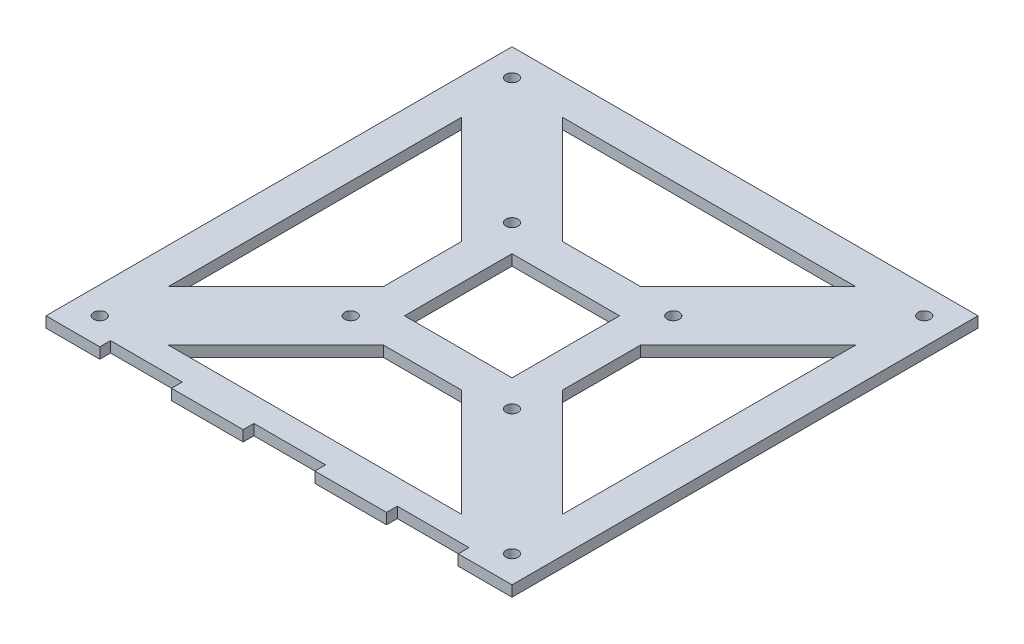
from build123d import *

# Parameters (mm, degrees)
SKETCH1_W           = 130
SKETCH1_H           = 130
SKETCH1_W_2         = 30
SKETCH1_H_2         = 30
BOSS_EXTRUDE1_DEPTH = 3
CUT_EXTRUDE1_DEPTH  = 3
CUT_EXTRUDE2_DEPTH  = 3
SKETCH4_W           = 20
SKETCH4_H           = 3
SKETCH4_W_2         = 10
CUT_EXTRUDE3_DEPTH  = 10


with BuildPart() as part:
    # Sketch1 → Boss-Extrude1 (new body)
    with BuildSketch(Plane(origin=(0, 0, 0), x_dir=(1, 0, 0), z_dir=(0, 1, 0))):
        Rectangle(SKETCH1_W, SKETCH1_H)
        Polygon((-55, 40.857864376), (-25, 10.857864376), (-25, -10.857864376), (-55, -40.857864376), align=None, mode=Mode.SUBTRACT)
        Polygon((-40.857864376, -55), (-10.857864376, -25), (10.857864376, -25), (40.857864376, -55), align=None, mode=Mode.SUBTRACT)
        Polygon((55, -40.857864376), (25, -10.857864376), (25, 10.857864376), (55, 40.857864376), align=None, mode=Mode.SUBTRACT)
        Polygon((40.857864376, 55), (10.857864376, 25), (-10.857864376, 25), (-40.857864376, 55), align=None, mode=Mode.SUBTRACT)
        Rectangle(SKETCH1_W_2, SKETCH1_H_2, mode=Mode.SUBTRACT)
    extrude(amount=BOSS_EXTRUDE1_DEPTH)

    # Sketch2 → Cut-Extrude1 (cut)
    with BuildSketch(Plane(origin=(0, 3, 0), x_dir=(1, 0, 0), z_dir=(0, 1, 0))):
        with BuildLine():
            ThreePointArc((-55.8, 57.5), (-58.702081528, 58.702081528), (-57.5, 55.8))
            Line((-57.5, 55.8), (-57.5, 57.5))
            Line((-57.5, 57.5), (-55.8, 57.5))
        make_face()
        with BuildLine():
            Line((-57.5, 57.5), (-57.5, 55.8))
            ThreePointArc((-57.5, 55.8), (-56.297918472, 56.297918472), (-55.8, 57.5))
            Line((-55.8, 57.5), (-57.5, 57.5))
        make_face()
        with BuildLine():
            Line((-57.5, -55.8), (-57.5, -57.5))
            Line((-57.5, -57.5), (-55.8, -57.5))
            ThreePointArc((-55.8, -57.5), (-56.297918472, -56.297918472), (-57.5, -55.8))
        make_face()
        with BuildLine():
            Line((-55.8, -57.5), (-57.5, -57.5))
            Line((-57.5, -57.5), (-57.5, -55.8))
            ThreePointArc((-57.5, -55.8), (-58.702081528, -58.702081528), (-55.8, -57.5))
        make_face()
        with BuildLine():
            ThreePointArc((57.5, -55.8), (56.297918472, -56.297918472), (55.8, -57.5))
            Line((55.8, -57.5), (57.5, -57.5))
            Line((57.5, -57.5), (57.5, -55.8))
        make_face()
        with BuildLine():
            Line((57.5, -57.5), (55.8, -57.5))
            ThreePointArc((55.8, -57.5), (57.5, -59.2), (59.2, -57.5))
            ThreePointArc((59.2, -57.5), (58.702081528, -56.297918472), (57.5, -55.8))
            Line((57.5, -55.8), (57.5, -57.5))
        make_face()
        with BuildLine():
            ThreePointArc((55.8, 57.5), (56.297918472, 56.297918472), (57.5, 55.8))
            Line((57.5, 55.8), (57.5, 57.5))
            Line((57.5, 57.5), (55.8, 57.5))
        make_face()
        with BuildLine():
            Line((57.5, 57.5), (57.5, 55.8))
            ThreePointArc((57.5, 55.8), (58.702081528, 56.297918472), (59.2, 57.5))
            ThreePointArc((59.2, 57.5), (57.5, 59.2), (55.8, 57.5))
            Line((55.8, 57.5), (57.5, 57.5))
        make_face()
    extrude(amount=-CUT_EXTRUDE1_DEPTH, mode=Mode.SUBTRACT)

    # Sketch3 → Cut-Extrude2 (cut)
    with BuildSketch(Plane(origin=(0, 3, 0), x_dir=(1, 0, 0), z_dir=(0, 1, 0))):
        with BuildLine():
            Line((-22.5, -20.8), (-22.5, -22.5))
            Line((-22.5, -22.5), (-20.8, -22.5))
            ThreePointArc((-20.8, -22.5), (-21.297918472, -21.297918472), (-22.5, -20.8))
        make_face()
        with BuildLine():
            Line((-20.8, -22.5), (-22.5, -22.5))
            Line((-22.5, -22.5), (-22.5, -20.8))
            ThreePointArc((-22.5, -20.8), (-23.702081528, -23.702081528), (-20.8, -22.5))
        make_face()
        with BuildLine():
            ThreePointArc((-20.8, 22.5), (-23.702081528, 23.702081528), (-22.5, 20.8))
            Line((-22.5, 20.8), (-22.5, 22.5))
            Line((-22.5, 22.5), (-20.8, 22.5))
        make_face()
        with BuildLine():
            Line((-22.5, 22.5), (-22.5, 20.8))
            ThreePointArc((-22.5, 20.8), (-21.297918472, 21.297918472), (-20.8, 22.5))
            Line((-20.8, 22.5), (-22.5, 22.5))
        make_face()
        with BuildLine():
            ThreePointArc((22.5, -20.8), (21.297918472, -21.297918472), (20.8, -22.5))
            Line((20.8, -22.5), (22.5, -22.5))
            Line((22.5, -22.5), (22.5, -20.8))
        make_face()
        with BuildLine():
            Line((22.5, -22.5), (20.8, -22.5))
            ThreePointArc((20.8, -22.5), (22.5, -24.2), (24.2, -22.5))
            ThreePointArc((24.2, -22.5), (23.702081528, -21.297918472), (22.5, -20.8))
            Line((22.5, -20.8), (22.5, -22.5))
        make_face()
        with BuildLine():
            ThreePointArc((20.8, 22.5), (21.297918472, 21.297918472), (22.5, 20.8))
            Line((22.5, 20.8), (22.5, 22.5))
            Line((22.5, 22.5), (20.8, 22.5))
        make_face()
        with BuildLine():
            Line((22.5, 22.5), (22.5, 20.8))
            ThreePointArc((22.5, 20.8), (23.702081528, 21.297918472), (24.2, 22.5))
            ThreePointArc((24.2, 22.5), (22.5, 24.2), (20.8, 22.5))
            Line((20.8, 22.5), (22.5, 22.5))
        make_face()
    extrude(amount=-CUT_EXTRUDE2_DEPTH, mode=Mode.SUBTRACT)

    # Sketch4 → Cut-Extrude3 (cut)
    with BuildSketch(Plane.XZ):
        with Locations((40, 63.5)):
            Rectangle(SKETCH4_W, SKETCH4_H)
        with Locations((5, 63.5)):
            Rectangle(SKETCH4_W_2, SKETCH4_H)
        with Locations((-5, 63.5)):
            Rectangle(SKETCH4_W_2, SKETCH4_H)
        with Locations((-40, 63.5)):
            Rectangle(SKETCH4_W, SKETCH4_H)
    extrude(amount=-CUT_EXTRUDE3_DEPTH, mode=Mode.SUBTRACT)


solid = part.part
